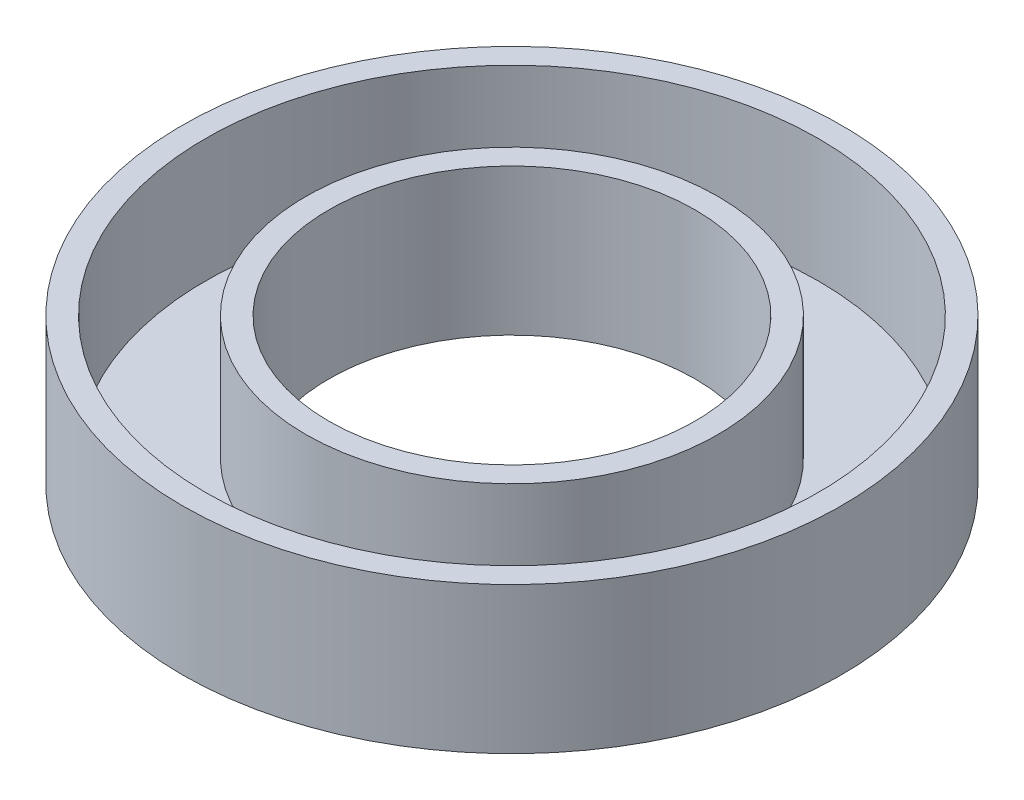
from build123d import *

# Parameters (mm, degrees)
SKETCH1_R            = 14.2875
MAIN_EXTRUSION_DEPTH = 6.35
SKETCH2_R            = 7.9375
ID_BORE_DEPTH        = 20
SKETCH3_R            = 13.2875
SKETCH3_R_2          = 8.9375
SEAL_RECESS_DEPTH    = 5.35


with BuildPart() as part:
    # Sketch1 → main extrusion (new body)
    with BuildSketch(Plane(origin=(0, 0, 0), x_dir=(1, 0, 0), z_dir=(0, 1, 0))):
        with Locations(Location((0, 0, 0), (0, 0, 270))):
            Circle(SKETCH1_R)
    extrude(amount=MAIN_EXTRUSION_DEPTH)

    # Sketch2 → ID bore (cut)
    with BuildSketch(Plane(origin=(0, 6.35, 0), x_dir=(1, 0, 0), z_dir=(0, 1, 0))):
        with Locations(Location((0, 0, 0), (0, 0, 270))):
            Circle(SKETCH2_R)
    extrude(amount=-ID_BORE_DEPTH, mode=Mode.SUBTRACT)

    # Sketch3 → seal recess (cut)
    with BuildSketch(Plane(origin=(0, 6.35, 0), x_dir=(1, 0, 0), z_dir=(0, 1, 0))):
        with Locations(Location((0, 0, 0), (0, 0, 270))):
            Circle(SKETCH3_R)
        with Locations(Location((0, 0, 0), (0, 0, 270))):
            Circle(SKETCH3_R_2, mode=Mode.SUBTRACT)
    extrude(amount=-SEAL_RECESS_DEPTH, mode=Mode.SUBTRACT)


solid = part.part
